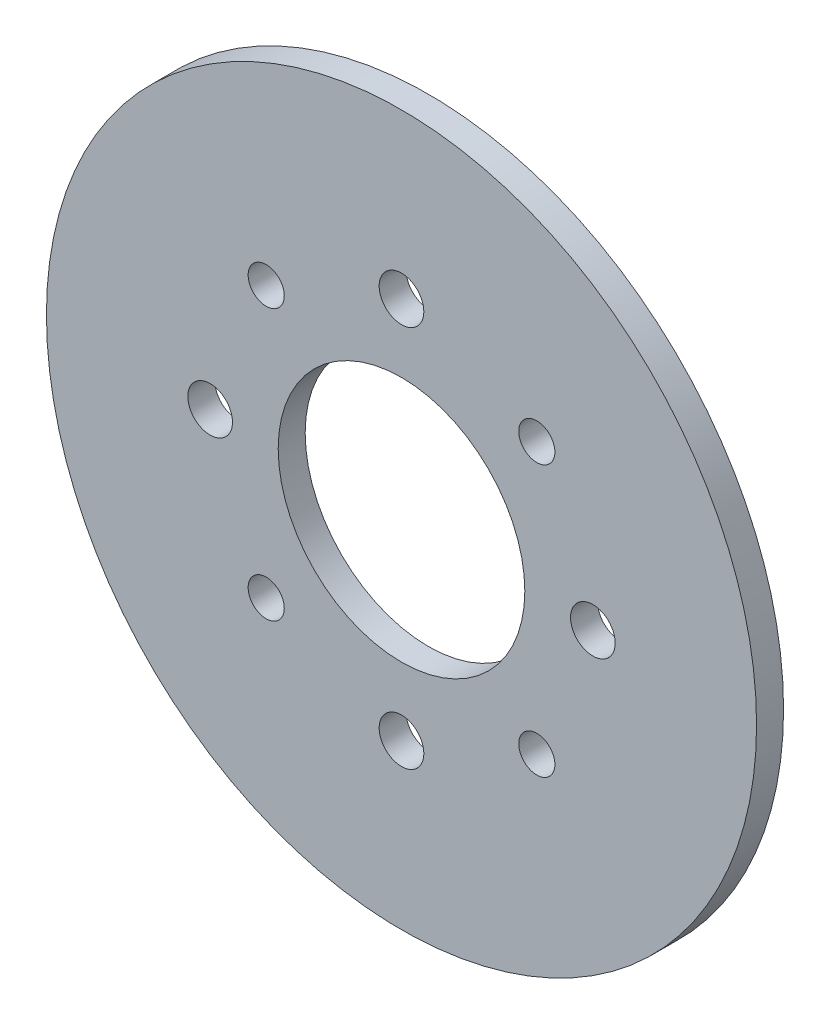
from build123d import *

# Parameters (mm, degrees)
SKETCH1_R           = 83.503370476
SKETCH1_R_2         = 5.25
SKETCH1_R_3         = 4.25
SKETCH1_R_4         = 29
BOSS_EXTRUDE1_DEPTH = 6.35


with BuildPart() as part:
    # Sketch1 → Boss-Extrude1 (new body)
    with BuildSketch(Plane.XY):
        Circle(SKETCH1_R)
        with Locations((0, 45)):
            Circle(SKETCH1_R_2, mode=Mode.SUBTRACT)
        with Locations((45, 0)):
            Circle(SKETCH1_R_2, mode=Mode.SUBTRACT)
        with Locations((0, -45)):
            Circle(SKETCH1_R_2, mode=Mode.SUBTRACT)
        with Locations((-45, 0)):
            Circle(SKETCH1_R_2, mode=Mode.SUBTRACT)
        with Locations((31.819805153, 31.819805153)):
            Circle(SKETCH1_R_3, mode=Mode.SUBTRACT)
        with Locations((31.819805153, -31.819805153)):
            Circle(SKETCH1_R_3, mode=Mode.SUBTRACT)
        with Locations((-31.819805153, -31.819805153)):
            Circle(SKETCH1_R_3, mode=Mode.SUBTRACT)
        with Locations((-31.819805153, 31.819805153)):
            Circle(SKETCH1_R_3, mode=Mode.SUBTRACT)
        Circle(SKETCH1_R_4, mode=Mode.SUBTRACT)
    extrude(amount=BOSS_EXTRUDE1_DEPTH)


solid = part.part
